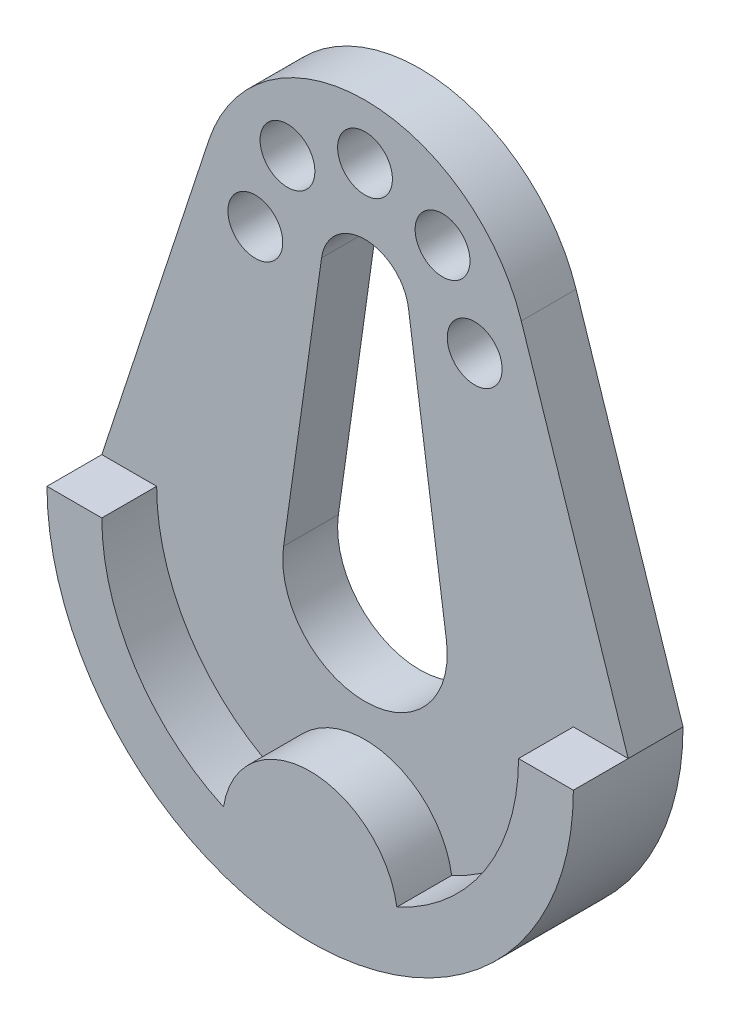
from build123d import *

# Parameters (mm, degrees)
SKETCH1_R           = 5
BOSS_EXTRUDE1_DEPTH = 10
BOSS_EXTRUDE2_DEPTH = 20


with BuildPart() as part:
    # Sketch1 → Boss-Extrude1 (new body)
    with BuildSketch(Plane.XY):
        with BuildLine():
            Line((38, 0), (48, 0))
            Line((48, 0), (28.501872629, 59.361797724))
            ThreePointArc((28.501872629, 59.361797724), (0, 80), (-28.501872629, 59.361797724))
            Line((-28.501872629, 59.361797724), (-48, 0))
            Line((-48, 0), (-38, 0))
            ThreePointArc((-38, 0), (-31.975409318, -20.532247781), (-15.811936897, -34.554054054))
            ThreePointArc((-15.811936897, -34.554054054), (0, -21), (15.811936897, -34.554054054))
            ThreePointArc((15.811936897, -34.554054054), (31.975409318, -20.532247781), (38, 0))
        make_face()
        with Locations((-20, 50)):
            Circle(SKETCH1_R, mode=Mode.SUBTRACT)
        with Locations((-14.142135624, 64.142135624)):
            Circle(SKETCH1_R, mode=Mode.SUBTRACT)
        with BuildLine():
            Line((7.921212028, 51.12), (14.852272553, 2.1))
            ThreePointArc((14.852272553, 2.1), (0, -15), (-14.852272553, 2.1))
            Line((-14.852272553, 2.1), (-7.921212028, 51.12))
            ThreePointArc((-7.921212028, 51.12), (0, 58), (7.921212028, 51.12))
        make_face(mode=Mode.SUBTRACT)
        with Locations((20, 50)):
            Circle(SKETCH1_R, mode=Mode.SUBTRACT)
        with Locations((0, 70)):
            Circle(SKETCH1_R, mode=Mode.SUBTRACT)
        with Locations((14.142135624, 64.142135624)):
            Circle(SKETCH1_R, mode=Mode.SUBTRACT)
    extrude(amount=BOSS_EXTRUDE1_DEPTH)

    # Sketch1<3> → Boss-Extrude2 (add)
    with BuildSketch(Plane.XY):
        with BuildLine():
            ThreePointArc((-48, 0), (0, -48), (48, 0))
            Line((48, 0), (38, 0))
            ThreePointArc((38, 0), (31.975409318, -20.532247781), (15.811936897, -34.554054054))
            ThreePointArc((15.811936897, -34.554054054), (0, -21), (-15.811936897, -34.554054054))
            ThreePointArc((-15.811936897, -34.554054054), (-31.975409318, -20.532247781), (-38, 0))
            Line((-38, 0), (-48, 0))
        make_face()
    extrude(amount=BOSS_EXTRUDE2_DEPTH)


solid = part.part
